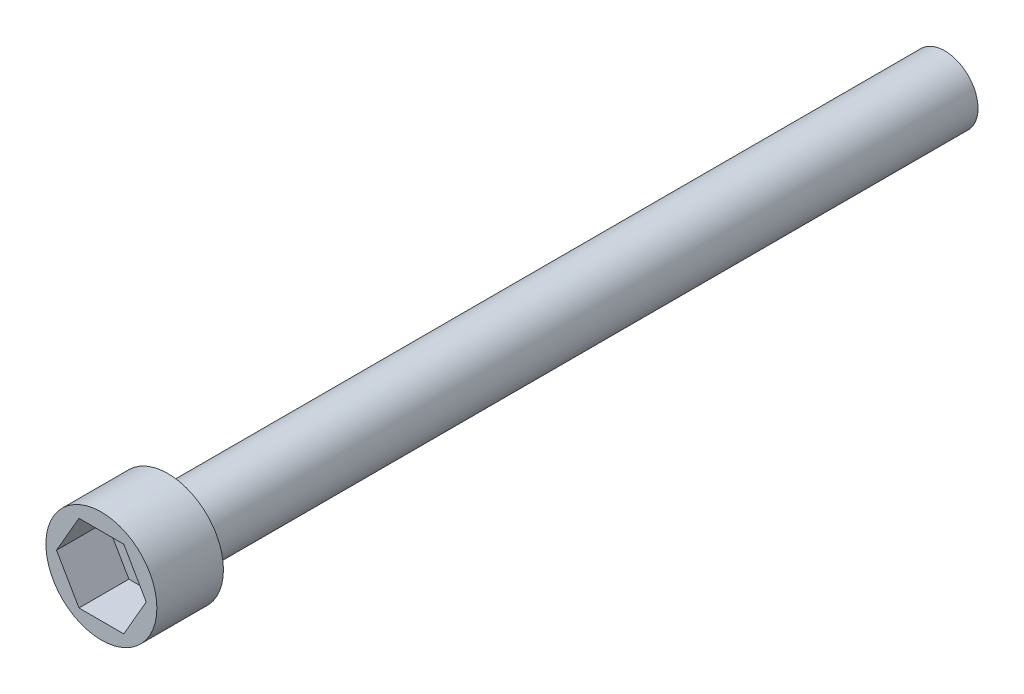
from build123d import *

# Parameters (mm, degrees)
ESQUISSE1_R             = 3
BOSS_EXTRU_1_DEPTH      = 70
ESQUISSE2_R             = 5
BOSS_EXTRU_2_DEPTH      = 6
ENL_V_MAT_EXTRU_1_DEPTH = 4.5


with BuildPart() as part:
    # Esquisse1 → Boss.-Extru.1 (new body)
    with BuildSketch(Plane.XY):
        Circle(ESQUISSE1_R)
    extrude(amount=BOSS_EXTRU_1_DEPTH)

    # Esquisse2 → Boss.-Extru.2 (add)
    with BuildSketch(Plane.XY.offset(70)):
        Circle(ESQUISSE2_R)
    extrude(amount=BOSS_EXTRU_2_DEPTH)

    # Esquisse3 → Enlèv. mat.-Extru.1 (cut)
    with BuildSketch(Plane.XY.offset(76)):
        Polygon((4.041451884, 0), (2.020725942, 3.5), (-2.020725942, 3.5), (-4.041451884, 0), (-2.020725942, -3.5), (2.020725942, -3.5), align=None)
    extrude(amount=-ENL_V_MAT_EXTRU_1_DEPTH, mode=Mode.SUBTRACT)


solid = part.part
